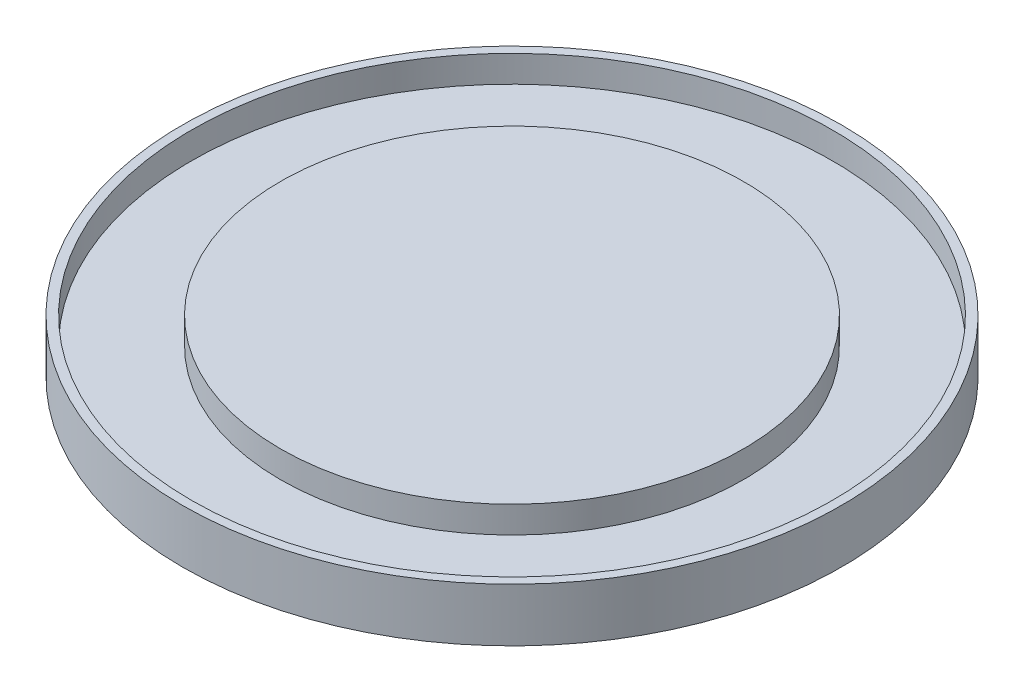
from build123d import *

# Parameters (mm, degrees)
SKETCH1_R           = 18.5
BOSS_EXTRUDE1_DEPTH = 3
SKETCH2_R           = 18
SKETCH2_R_2         = 13
CUT_EXTRUDE1_DEPTH  = 1.5
SCALE1_SCALE        = 0.8


with BuildPart() as part:
    # Sketch1 → Boss-Extrude1 (new body)
    with BuildSketch(Plane(origin=(0, 0, 0), x_dir=(1, 0, 0), z_dir=(0, 1, 0))):
        with Locations(Location((0, 0, 0), (0, 0, 270))):
            Circle(SKETCH1_R)
    extrude(amount=BOSS_EXTRUDE1_DEPTH)

    # Sketch2 → Cut-Extrude1 (cut)
    with BuildSketch(Plane(origin=(0, 3, 0), x_dir=(1, 0, 0), z_dir=(0, 1, 0))):
        with Locations(Location((0, 0, 0), (0, 0, 270))):
            Circle(SKETCH2_R)
        with Locations(Location((0, 0, 0), (0, 0, 270))):
            Circle(SKETCH2_R_2, mode=Mode.SUBTRACT)
    extrude(amount=-CUT_EXTRUDE1_DEPTH, mode=Mode.SUBTRACT)


with BuildPart() as part_1:
    # Scale1: scaled about (0, 1.280453258, 0)
    add(part.part.scale(SCALE1_SCALE).moved(Location((0, 0.256090652, 0))))


solid = part_1.part
